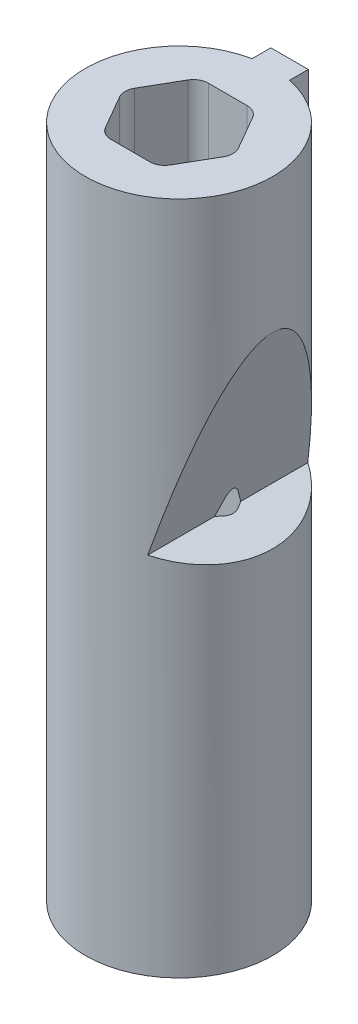
from build123d import *

# Parameters (mm, degrees)
SKETCH1_R               = 2.5
BOSS_EXTRUDE1_DEPTH     = 18
SKETCH3_W               = 1
SKETCH3_H               = 0.5
BOSS_EXTRUDE2_DEPTH     = 5
CUT_EXTRUDE1_DEPTH      = 4
CUT_EXTRUDE1_DEPTH_BACK = 4
CUT_EXTRUDE2_DEPTH      = 34


with BuildPart() as part:
    # Sketch1 → Boss-Extrude1 (new body)
    with BuildSketch(Plane(origin=(0, 0, 0), x_dir=(1, 0, 0), z_dir=(0, 1, 0))):
        Circle(SKETCH1_R)
    extrude(amount=BOSS_EXTRUDE1_DEPTH)

    # Sketch3 → Boss-Extrude2 (add)
    with BuildSketch(Plane(origin=(0, 18, 0), x_dir=(1, 0, 0), z_dir=(0, 1, 0))):
        with Locations((0, 2.699489743)):
            Rectangle(SKETCH3_W, SKETCH3_H)
    extrude(amount=-BOSS_EXTRUDE2_DEPTH)

    # Sketch5 → Cut-Extrude1 (cut, two sides: drawn at the far end of the back side and taken through both)
    with BuildSketch(Plane.XY.offset(-CUT_EXTRUDE1_DEPTH_BACK)):
        Polygon((2.5, 14.4), (1.3, 9.721539031), (2.5, 9.4), align=None)
    extrude(amount=CUT_EXTRUDE1_DEPTH + CUT_EXTRUDE1_DEPTH_BACK, mode=Mode.SUBTRACT)

    # Sketch4 → Cut-Extrude2 (cut)
    with BuildSketch(Plane.XZ):
        with BuildLine():
            Line((-0.519059892, -1.299038106), (0.519059892, -1.299038106))
            ThreePointArc((0.519059892, -1.299038106), (0.719059892, -1.245448267), (0.865470054, -1.099038106))
            Line((0.865470054, -1.099038106), (1.384529946, -0.2))
            ThreePointArc((1.384529946, -0.2), (1.438119785, 0), (1.384529946, 0.2))
            Line((1.384529946, 0.2), (0.865470054, 1.099038106))
            ThreePointArc((0.865470054, 1.099038106), (0.719059892, 1.245448267), (0.519059892, 1.299038106))
            Line((0.519059892, 1.299038106), (-0.519059892, 1.299038106))
            ThreePointArc((-0.519059892, 1.299038106), (-0.719059892, 1.245448267), (-0.865470054, 1.099038106))
            Line((-0.865470054, 1.099038106), (-1.384529946, 0.2))
            ThreePointArc((-1.384529946, 0.2), (-1.438119785, 0), (-1.384529946, -0.2))
            Line((-1.384529946, -0.2), (-0.865470054, -1.099038106))
            ThreePointArc((-0.865470054, -1.099038106), (-0.719059892, -1.245448267), (-0.519059892, -1.299038106))
        make_face()
    extrude(amount=-CUT_EXTRUDE2_DEPTH, mode=Mode.SUBTRACT)


solid = part.part
